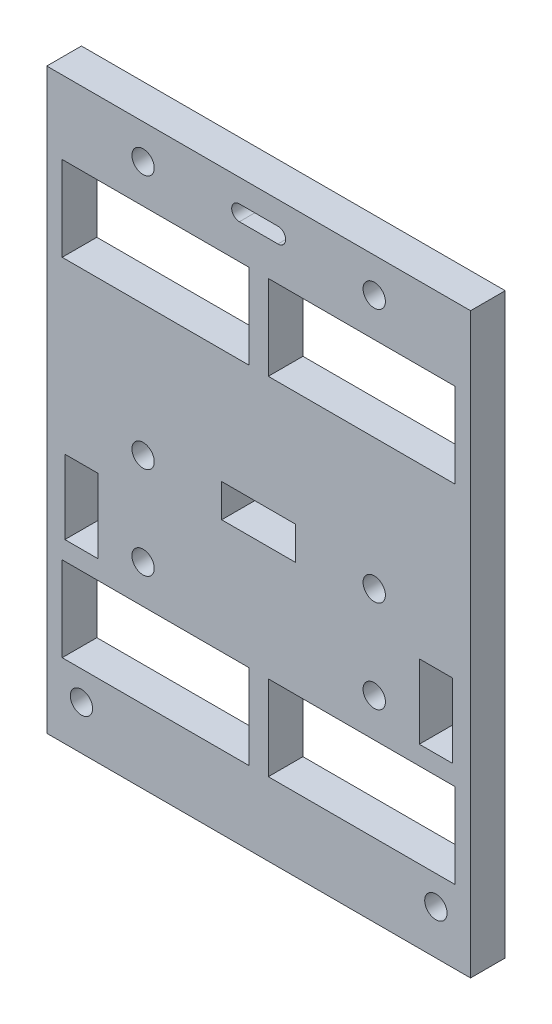
from build123d import *

# Parameters (mm, degrees)
SKETCH1_W                 = 55
SKETCH1_H                 = 75
SKETCH1_W_2               = 24.25
SKETCH1_H_2               = 11
BOSS_EXTRUDE1_DEPTH       = 4.5
SKETCH2_R                 = 1.45
SCREWHOLES_DEPTH          = 47.719910103
SKETCH4_W                 = 9.6
SKETCH4_H                 = 4.3
MOUNTINGPLATETAB_DEPTH    = 47.719910103
SKETCH5_R                 = 1.45
SKETCH5_W                 = 4.3
SKETCH5_H                 = 9.6
BRACETABS_DEPTH           = 47.719910103
SKETCH8_R                 = 1.45
EXPANSIONSCREWHOLES_DEPTH = 47.719910103
CABLETIESLOT_DEPTH        = 47.719910103


with BuildPart() as part:
    # Sketch1 → Boss-Extrude1 (new body)
    with BuildSketch(Plane.XY):
        Rectangle(SKETCH1_W, SKETCH1_H)
        with Locations((-13.375, 22.5)):
            Rectangle(SKETCH1_W_2, SKETCH1_H_2, mode=Mode.SUBTRACT)
        with Locations((13.375, 22.5)):
            Rectangle(SKETCH1_W_2, SKETCH1_H_2, mode=Mode.SUBTRACT)
        with Locations((13.375, -22.5)):
            Rectangle(SKETCH1_W_2, SKETCH1_H_2, mode=Mode.SUBTRACT)
        with Locations((-13.375, -22.5)):
            Rectangle(SKETCH1_W_2, SKETCH1_H_2, mode=Mode.SUBTRACT)
    extrude(amount=BOSS_EXTRUDE1_DEPTH)

    # Sketch2 → screwHoles (cut, through all)
    with BuildSketch(Plane.XY.offset(4.5)):
        with Locations((-15, 33)):
            Circle(SKETCH2_R)
        with Locations(Location((15, 33, 0), (0, 0, 180))):
            Circle(SKETCH2_R)
        with Locations((15, 0)):
            Circle(SKETCH2_R)
        with Locations(Location((-15, 0, 0), (0, 0, 180))):
            Circle(SKETCH2_R)
    extrude(amount=-SCREWHOLES_DEPTH, mode=Mode.SUBTRACT)

    # Sketch4 → mountingPlateTab (cut, through all)
    with BuildSketch(Plane.XY.offset(4.5)):
        Rectangle(SKETCH4_W, SKETCH4_H)
    extrude(amount=-MOUNTINGPLATETAB_DEPTH, mode=Mode.SUBTRACT)

    # Sketch5 → BraceTabs (cut, through all)
    with BuildSketch(Plane.XY.offset(4.5)):
        with Locations((23, -31.75)):
            Circle(SKETCH5_R)
        with Locations(Location((-23, -31.75, 0), (0, 0, 180))):
            Circle(SKETCH5_R)
        with Locations((23, -9.75)):
            Rectangle(SKETCH5_W, SKETCH5_H)
        with Locations((-23, -9.75)):
            Rectangle(SKETCH5_W, SKETCH5_H)
    extrude(amount=-BRACETABS_DEPTH, mode=Mode.SUBTRACT)

    # Sketch8 → ExpansionScrewholes (cut, through all)
    with BuildSketch(Plane.XY.offset(4.5)):
        with Locations((-15, -12)):
            Circle(SKETCH8_R)
        with Locations(Location((15, -12, 0), (0, 0, 180))):
            Circle(SKETCH8_R)
    extrude(amount=-EXPANSIONSCREWHOLES_DEPTH, mode=Mode.SUBTRACT)

    # Sketch12 → CableTieSlot (cut, through all)
    with BuildSketch(Plane.XY.offset(4.5)):
        with BuildLine():
            Line((-2.5, 34.5), (2.5, 34.5))
            ThreePointArc((2.5, 34.5), (3.5, 33.5), (2.5, 32.5))
            Line((2.5, 32.5), (-2.5, 32.5))
            ThreePointArc((-2.5, 32.5), (-3.5, 33.5), (-2.5, 34.5))
        make_face()
    extrude(amount=-CABLETIESLOT_DEPTH, mode=Mode.SUBTRACT)


solid = part.part
